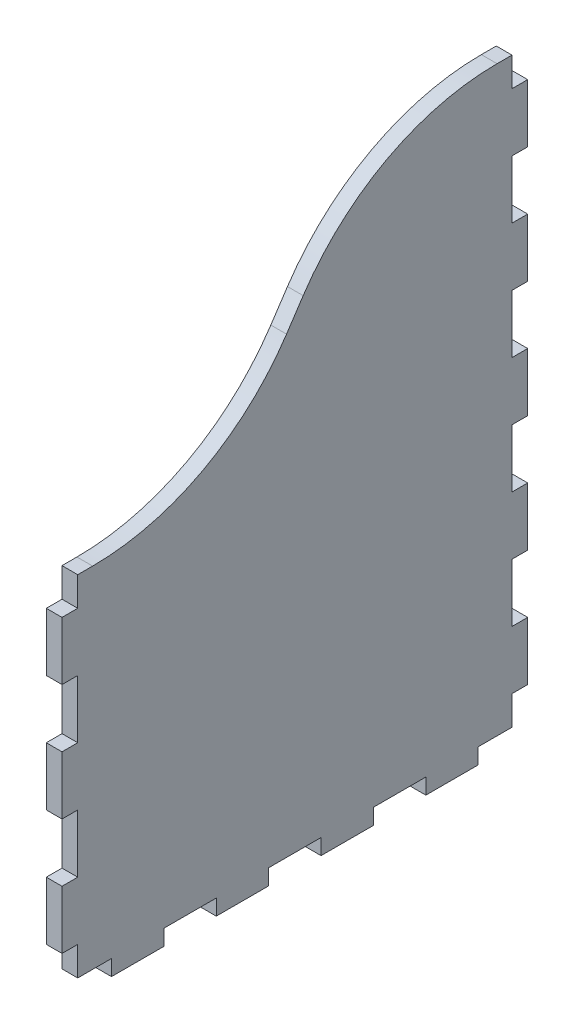
from build123d import *

# Parameters (mm, degrees)
BOSS_EXTRU_1_DEPTH              = 2.7
ESQUISSE2_W                     = 9
ESQUISSE2_H                     = 2.7
BOSS_EXTRU_2_DEPTH              = 2.7
R_P_TITION_LIN_AIRE1_COUNT      = 3
R_P_TITION_LIN_AIRE1_PITCH      = 18
R_P_TITION_LIN_AIRE1_COL_COUNT  = 2
R_P_TITION_LIN_AIRE1_COL_PITCH  = 18
ESQUISSE3_W                     = 2.7
ESQUISSE3_H                     = 10
BOSS_EXTRU_3_DEPTH              = 2.7
R_P_TITION_LIN_AIRE2_COUNT      = 5
R_P_TITION_LIN_AIRE2_PITCH      = 20
R_P_TITION_LIN_AIRE2_COUNT_DIR2 = 2
R_P_TITION_LIN_AIRE2_PITCH_DIR2 = 77.3
CONG_1_R                        = 40


with BuildPart() as part:
    # Esquisse1 → Boss.-Extru.1 (new body)
    with BuildSketch(Plane(origin=(0, 0, 0), x_dir=(0, 0, -1), z_dir=(1, 0, 0))):
        Polygon((37.3, 100), (13.3, 100), (-13.3, 60), (-37.3, 60), (-37.3, 0), (37.3, 0), align=None)
    extrude(amount=BOSS_EXTRU_1_DEPTH)

    # Esquisse2 → Boss.-Extru.2 (add)
    with BuildSketch(Plane(origin=(0, 0, 0), x_dir=(0, 0, -1), z_dir=(1, 0, 0))):
        with Locations((-9, -1.35)):
            Rectangle(ESQUISSE2_W, ESQUISSE2_H)
    boss_extru_2 = extrude(amount=BOSS_EXTRU_2_DEPTH)

    # Répétition linéaire1: Boss.-Extru.2 ×3
    with Locations(*[(0, 0, -i * R_P_TITION_LIN_AIRE1_PITCH) for i in range(1, R_P_TITION_LIN_AIRE1_COUNT)]):
        add(boss_extru_2)

    # Répétition linéaire1 col: Boss.-Extru.2 ×2
    with Locations(*[(0, 0, i * R_P_TITION_LIN_AIRE1_COL_PITCH) for i in range(1, R_P_TITION_LIN_AIRE1_COL_COUNT)]):
        add(boss_extru_2)

    # Esquisse3 → Boss.-Extru.3 (add)
    with BuildSketch(Plane(origin=(0, 0, 0), x_dir=(0, 0, -1), z_dir=(1, 0, 0))):
        with Locations((-38.65, 10)):
            Rectangle(ESQUISSE3_W, ESQUISSE3_H)
    boss_extru_3 = extrude(amount=BOSS_EXTRU_3_DEPTH)

    # Répétition linéaire2: Boss.-Extru.3 5 × 2, 2 skipped
    with Locations(*[(0, i * R_P_TITION_LIN_AIRE2_PITCH, -j * R_P_TITION_LIN_AIRE2_PITCH_DIR2) for i in range(R_P_TITION_LIN_AIRE2_COUNT) for j in range(R_P_TITION_LIN_AIRE2_COUNT_DIR2) if (i, j) not in ((0, 0), (3, 0), (4, 0))]):
        add(boss_extru_3)

    # Congé1
    cong_1_edges = [part.edges().sort_by_distance(p)[0] for p in [
        (1.35, 60, 13.3),
        (1.35, 100, -13.3),
    ]]
    fillet(cong_1_edges, radius=CONG_1_R)


solid = part.part
